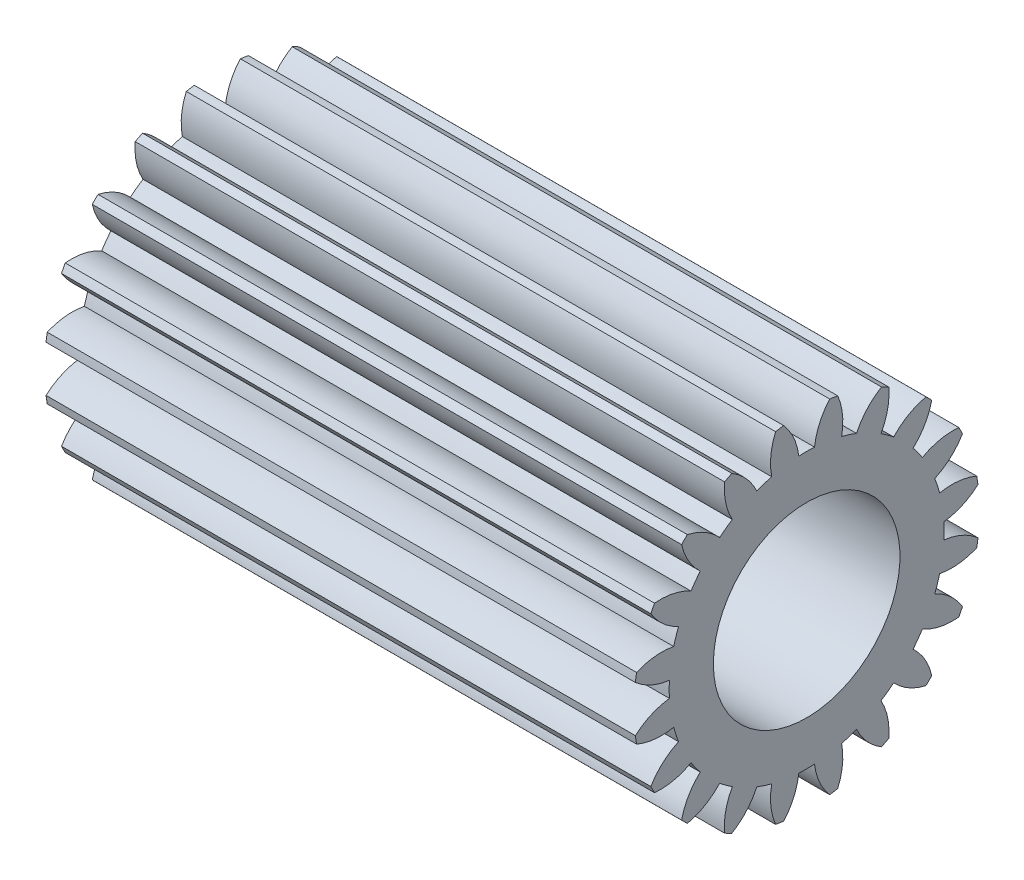
from build123d import *

# Parameters (mm, degrees)
BASPROSKE_W     = 15
BASPROSKE_H     = 4.4
TOOTHCUT_DEPTH  = 17.239458119
TEETHCUTS_COUNT = 20
TEETHCUTS_ANGLE = 342
BORSKE_R        = 2.375
BORE_DEPTH      = 50.0000508


with BuildPart() as part:
    # BasProSke → Base-Revolve (revolve)
    with BuildSketch(Plane(origin=(0, 0, 0), x_dir=(1, 0, 0), z_dir=(0, 1, 0)), mode=Mode.PRIVATE) as base_revolve_sk:
        with Locations((7.5, 2.2)):
            Rectangle(BASPROSKE_W, BASPROSKE_H)
    revolve(base_revolve_sk.sketch.rotate(Axis((-10, 0, 0), (1, 0, 0)), 180), axis=Axis((-10, 0, 0), (1, 0, 0)))

    # TooCutSke → ToothCut (cut, through all)
    with BuildSketch(Plane(origin=(0, 0, 0), x_dir=(0, 0, -1), z_dir=(1, 0, 0))):
        with BuildLine():
            ThreePointArc((0.199592598, 3.493302706), (0, 3.499), (-0.199592598, 3.493302706))
            ThreePointArc((-0.199592598, 3.493302706), (-0.333052166, 3.970347354), (-0.606028648, 4.383707841))
            ThreePointArc((-0.606028648, 4.383707841), (0, 4.4254), (0.606028648, 4.383707841))
            ThreePointArc((0.606028648, 4.383707841), (0.333052166, 3.970347354), (0.199592598, 3.493302706))
        make_face()
    toothcut = extrude(amount=TOOTHCUT_DEPTH, mode=Mode.SUBTRACT)

    # TeethCuts: ToothCut ×20 about axis
    teethcuts_axis = Axis((-10, 0, 0), (1, 0, 0))
    for i in range(1, TEETHCUTS_COUNT):
        add(toothcut.rotate(teethcuts_axis, i * TEETHCUTS_ANGLE / (TEETHCUTS_COUNT - 1)), mode=Mode.SUBTRACT)

    # BorSke → Bore (cut, symmetric)
    with BuildSketch(Plane(origin=(0, 0, 0), x_dir=(0, 0, -1), z_dir=(1, 0, 0))):
        with Locations(Location((0, 0, 0), (0, 0, 180))):
            Circle(BORSKE_R)
    extrude(amount=BORE_DEPTH, both=True, mode=Mode.SUBTRACT)


solid = part.part
